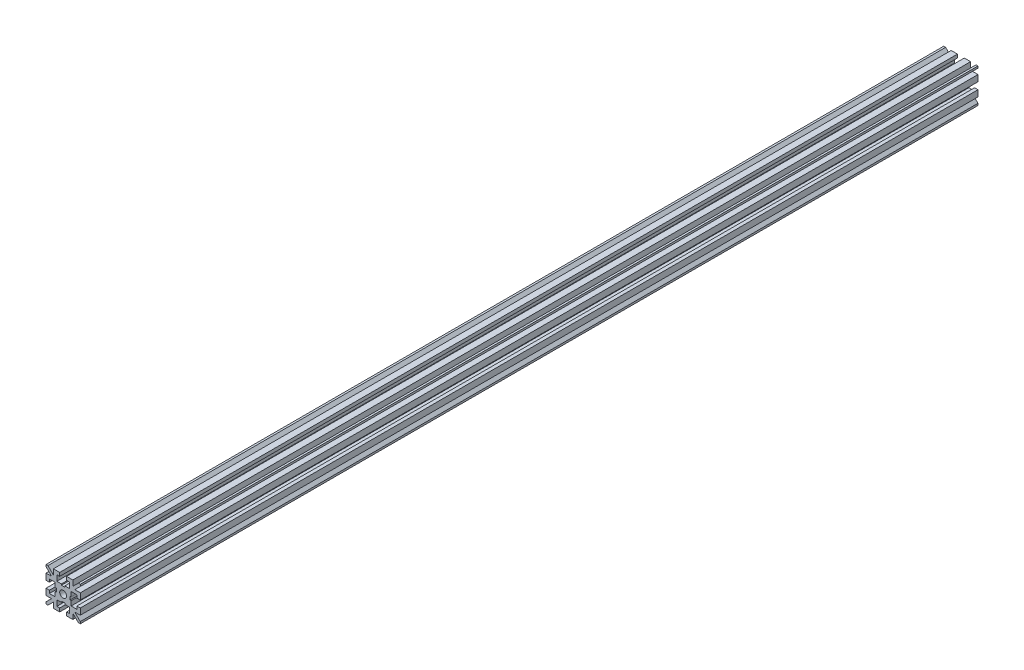
from build123d import *

# Parameters (mm, degrees)
SKETCH1_W           = 15
SKETCH1_H           = 15
BOSS_EXTRUDE1_DEPTH = 393
SKETCH2_R           = 1.5
CUT_EXTRUDE1_DEPTH  = 393
SKETCH3_W           = 3
SKETCH3_H           = 1.5
SKETCH3_W_2         = 1.5
SKETCH3_H_2         = 3
CUT_EXTRUDE2_DEPTH  = 393


with BuildPart() as part:
    # Sketch1 → Boss-Extrude1 (new body)
    with BuildSketch(Plane.XY):
        with Locations((-1.500578266, -3.738353388)):
            Rectangle(SKETCH1_W, SKETCH1_H)
    extrude(amount=BOSS_EXTRUDE1_DEPTH)

    # Sketch2 → Cut-Extrude1 (cut)
    with BuildSketch(Plane.XY.offset(393)):
        with Locations((-1.500578266, -3.738353388)):
            Circle(SKETCH2_R)
        Polygon((1.999421734, -4.488353388), (1.999421734, -6.488353388), (4.499421734, -6.488353388), (4.499421734, -0.988353388), (1.999421734, -0.988353388), (1.999421734, -2.988353388), (1.499421734, -2.988353388), (1.499421734, -4.488353388), align=None)
        Polygon((-4.250578266, -7.238353388), (-4.250578266, -9.738353388), (1.249421734, -9.738353388), (1.249421734, -7.238353388), (-0.750578266, -7.238353388), (-0.750578266, -6.738353388), (-2.250578266, -6.738353388), (-2.250578266, -7.238353388), align=None)
        Polygon((-5.000578266, -0.988353388), (-7.500578266, -0.988353388), (-7.500578266, -6.488353388), (-5.000578266, -6.488353388), (-5.000578266, -4.488353388), (-4.500578266, -4.488353388), (-4.500578266, -2.988353388), (-5.000578266, -2.988353388), align=None)
        Polygon((1.249421734, -0.238353388), (1.249421734, 2.261646612), (-4.250578266, 2.261646612), (-4.250578266, -0.238353388), (-2.250578266, -0.238353388), (-2.250578266, -0.738353388), (-0.750578266, -0.738353388), (-0.750578266, -0.238353388), align=None)
    extrude(amount=-CUT_EXTRUDE1_DEPTH, mode=Mode.SUBTRACT)

    # Sketch3 → Cut-Extrude2 (cut)
    with BuildSketch(Plane.XY.offset(393)):
        Polygon((5.150893596, 3.761646612), (2.749421734, 1.360174749), (2.749421734, 3.761646612), align=None)
        Polygon((5.999421734, 0.511646612), (5.999421734, 2.913118474), (3.597949871, 0.511646612), align=None)
        with Locations((-1.500578266, 3.011646612)):
            Rectangle(SKETCH3_W, SKETCH3_H)
        Polygon((2.749421734, -8.836881526), (2.749421734, -11.238353388), (5.150893596, -11.238353388), align=None)
        Polygon((5.999421734, -10.389825251), (3.597949871, -7.988353388), (5.999421734, -7.988353388), align=None)
        with Locations((5.249421734, -3.738353388)):
            Rectangle(SKETCH3_W_2, SKETCH3_H_2)
        Polygon((-6.599106404, -7.988353388), (-9.000578266, -7.988353388), (-9.000578266, -10.389825251), align=None)
        Polygon((-8.152050129, -11.238353388), (-5.750578266, -8.836881526), (-5.750578266, -11.238353388), align=None)
        with Locations((-1.500578266, -10.488353388)):
            Rectangle(SKETCH3_W, SKETCH3_H)
        Polygon((-5.750578266, 1.360174749), (-5.750578266, 3.761646612), (-8.152050129, 3.761646612), align=None)
        Polygon((-9.000578266, 2.913118474), (-6.599106404, 0.511646612), (-9.000578266, 0.511646612), align=None)
        with Locations((-8.250578266, -3.738353388)):
            Rectangle(SKETCH3_W_2, SKETCH3_H_2)
    extrude(amount=-CUT_EXTRUDE2_DEPTH, mode=Mode.SUBTRACT)


solid = part.part
